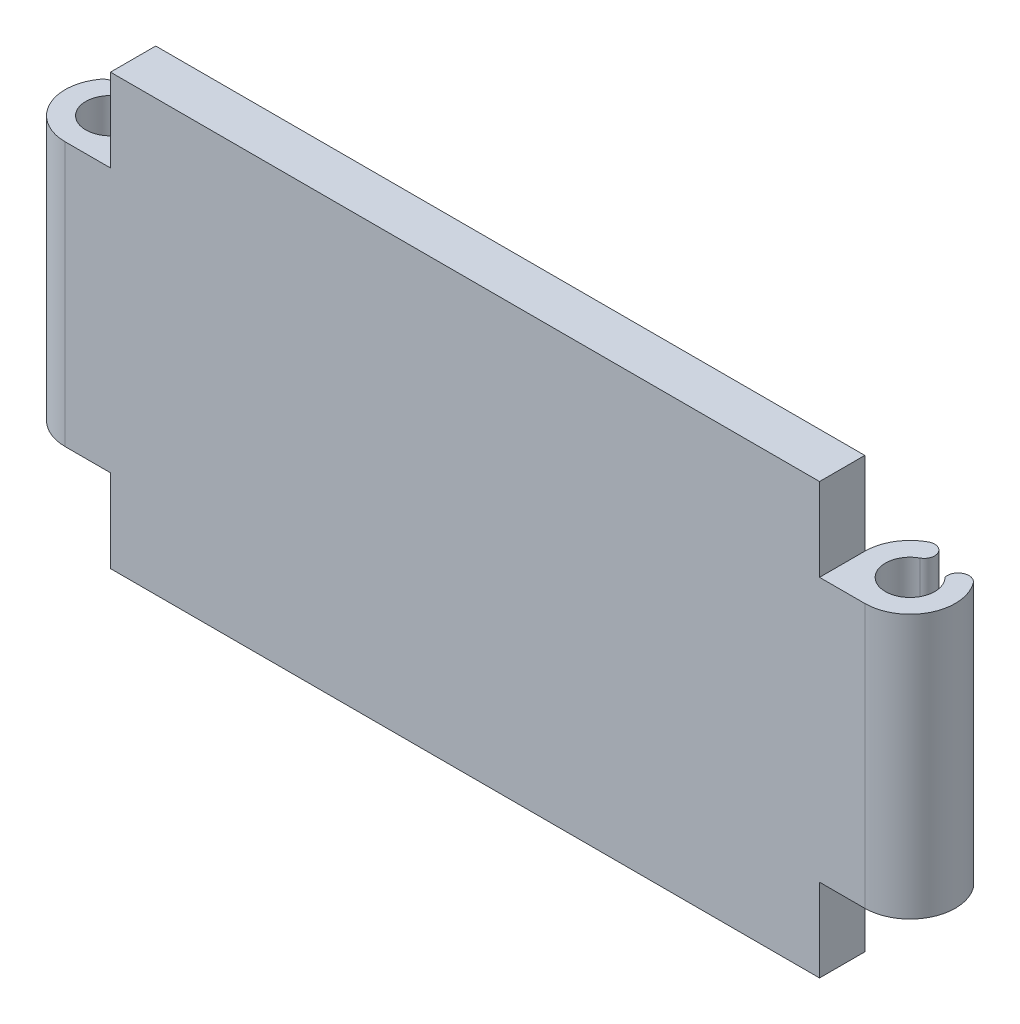
from build123d import *

# Parameters (mm, degrees)
RESSALTO_EXTRUS_O1_DEPTH = 57
CORTE_EXTRUS_O1_START    = -11
CORTE_EXTRUS_O1_DEPTH    = 11
CORTE_EXTRUS_O2_DEPTH    = 11


with BuildPart() as part:
    # Esboço1 → Ressalto-extrusão1 (new body)
    with BuildSketch(Plane(origin=(0, 0, 0), x_dir=(1, 0, 0), z_dir=(0, 1, 0))):
        with BuildLine():
            Line((-47, 0), (47, 0))
            ThreePointArc((47, 0), (47.85009345, 3.078711179), (50.159487509, 5.285024956))
            ThreePointArc((50.159487509, 5.285024956), (52.004661638, 4.729916917), (51.449553599, 2.884742789))
            ThreePointArc((51.449553599, 2.884742789), (52.536782743, -3.242075689), (55.296246294, 2.335139815))
            ThreePointArc((55.296246294, 2.335139815), (56.096189798, 3.978813584), (57.863892701, 3.513196237))
            ThreePointArc((57.863892701, 3.513196237), (58.342245662, -2.731375348), (53, -6))
            Line((53, -6), (-53, -6))
            ThreePointArc((-53, -6), (-58.342245662, -2.731375348), (-57.863892701, 3.513196237))
            ThreePointArc((-57.863892701, 3.513196237), (-56.096189798, 3.978813584), (-55.296246294, 2.335139815))
            ThreePointArc((-55.296246294, 2.335139815), (-52.536782743, -3.242075689), (-51.449553599, 2.884742789))
            ThreePointArc((-51.449553599, 2.884742789), (-52.004661638, 4.729916917), (-50.159487509, 5.285024956))
            ThreePointArc((-50.159487509, 5.285024956), (-47.85009345, 3.078711179), (-47, 0))
        make_face()
    extrude(amount=RESSALTO_EXTRUS_O1_DEPTH)

    # Esboço2 → Corte-extrusão1 (cut)
    with BuildSketch(Plane(origin=(0, 57, 0), x_dir=(1, 0, 0), z_dir=(0, 1, 0)).offset(CORTE_EXTRUS_O1_START)):
        with BuildLine():
            Line((47, 0), (47, -6))
            Line((47, -6), (53, -6))
            ThreePointArc((53, -6), (57.242640687, 4.242640687), (47, 0))
        make_face()
        with BuildLine():
            Line((-47, 0), (-47, -6))
            Line((-47, -6), (-53, -6))
            ThreePointArc((-53, -6), (-57.242640687, 4.242640687), (-47, 0))
        make_face()
    extrude(amount=CORTE_EXTRUS_O1_DEPTH, mode=Mode.SUBTRACT)

    # Esboço3 → Corte-extrusão2 (cut)
    with BuildSketch(Plane.XZ):
        with BuildLine():
            Line((-47, 0), (-47, 6))
            Line((-47, 6), (-53, 6))
            ThreePointArc((-53, 6), (-57.242640687, -4.242640687), (-47, 0))
        make_face()
        with BuildLine():
            Line((47, 0), (47, 6))
            Line((47, 6), (53, 6))
            ThreePointArc((53, 6), (57.242640687, -4.242640687), (47, 0))
        make_face()
    extrude(amount=-CORTE_EXTRUS_O2_DEPTH, mode=Mode.SUBTRACT)


solid = part.part
